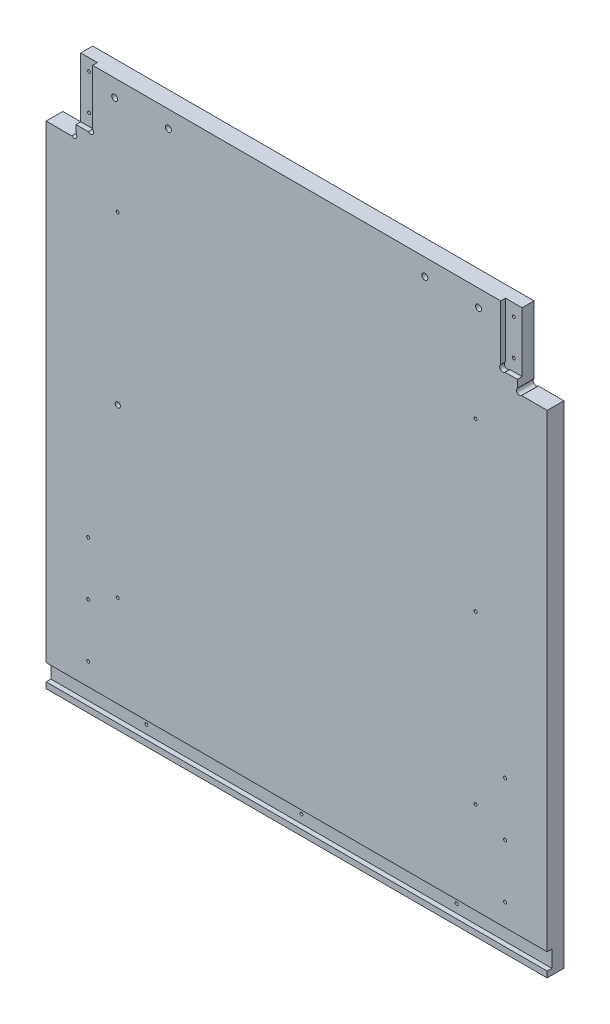
from build123d import *

# Parameters (mm, degrees)
EXTRUDE1_DEPTH     = 17.78
SKETCH4_R          = 3.175
SKETCH4_R_2        = 3.175000002
CUT_EXTRUDE1_DEPTH = 17.78
SKETCH6_R          = 1.5875
SKETCH6_R_2        = 2.777849083
CUT_EXTRUDE3_DEPTH = 17.78
SKETCH5_W          = 17.78
SKETCH5_H          = 63.50740041
SKETCH5_H_2        = 63.507400408
CUT_EXTRUDE2_DEPTH = 5.08
SKETCH7_R          = 3.302
CUT_EXTRUDE4_DEPTH = 5.08
SKETCH9_R          = 3.175
CUT_EXTRUDE5_DEPTH = 17.78


with BuildPart() as part:
    # Sketch3 → Extrude1 (new body)
    with BuildSketch(Plane.XY):
        Polygon((10806.641666666, -6342.0625), (11340.041666666, -6342.0625), (11340.041666666, -5818.736838581), (11308.291666667, -5818.736838581), (11308.291666667, -5742.536838581), (10838.391666667, -5742.536838581), (10838.391666667, -5818.736838581), (10806.641666666, -5818.736838581), align=None)
    extrude(amount=-EXTRUDE1_DEPTH)

    # Sketch4 → Cut-Extrude1 (cut)
    with BuildSketch(Plane.XY):
        with Locations((11310.536730697, -5816.491774551)):
            Circle(SKETCH4_R)
        with Locations((10836.146602637, -5816.491774551)):
            Circle(SKETCH4_R_2)
    extrude(amount=-CUT_EXTRUDE1_DEPTH, mode=Mode.SUBTRACT)

    # Sketch6 → Cut-Extrude3 (cut)
    with BuildSketch(Plane.XY):
        with Locations((10851.409166666, -6294.4375)):
            Circle(SKETCH6_R)
        with Locations((10908.241666666, -6326.8225)):
            Circle(SKETCH6_R)
        with Locations((11073.341666666, -6326.8225)):
            Circle(SKETCH6_R)
        with Locations((11238.441666666, -6326.8225)):
            Circle(SKETCH6_R)
        with Locations((11295.274166666, -6294.4375)):
            Circle(SKETCH6_R)
        with Locations((11295.274166666, -6237.2875)):
            Circle(SKETCH6_R)
        with Locations((11263.841666666, -6220.099669291)):
            Circle(SKETCH6_R)
        with Locations((11295.274166666, -6180.1375)):
            Circle(SKETCH6_R)
        with Locations((11263.841666666, -6042.299669291)):
            Circle(SKETCH6_R)
        with Locations((11263.841666666, -5864.499669291)):
            Circle(SKETCH6_R)
        with Locations((11299.401666666, -5793.344238991)):
            Circle(SKETCH6_R)
        with Locations((11299.401666666, -5755.236838581)):
            Circle(SKETCH6_R)
        with Locations((10847.281666666, -5755.236838581)):
            Circle(SKETCH6_R)
        with Locations((10847.281666666, -5793.344238991)):
            Circle(SKETCH6_R)
        with Locations((10882.841666666, -6042.299669291)):
            Circle(SKETCH6_R_2)
        with Locations((10851.409166666, -6180.1375)):
            Circle(SKETCH6_R)
        with Locations((10882.841666666, -6220.099669291)):
            Circle(SKETCH6_R)
        with Locations((10851.409166666, -6237.2875)):
            Circle(SKETCH6_R)
        with Locations((10882.841666666, -5864.499669291)):
            Circle(SKETCH6_R)
    extrude(amount=-CUT_EXTRUDE3_DEPTH, mode=Mode.SUBTRACT)

    # Sketch5 → Cut-Extrude2 (cut)
    with BuildSketch(Plane.XY):
        Polygon((11073.341666666, -6317.9325), (10806.641666666, -6317.9325), (10806.641666666, -6335.7125), (11340.041666666, -6335.7125), (11340.041666666, -6317.9325), align=None)
        with Locations((10847.281666667, -5774.290538786)):
            Rectangle(SKETCH5_W, SKETCH5_H)
        with Locations((11299.401666667, -5774.290538785)):
            Rectangle(SKETCH5_W, SKETCH5_H_2)
    extrude(amount=-CUT_EXTRUDE2_DEPTH, mode=Mode.SUBTRACT)

    # Sketch7 → Cut-Extrude4 (cut)
    with BuildSketch(Plane.XY):
        with Locations((10853.926602637, -5803.79917496)):
            Circle(SKETCH7_R)
        with Locations((11292.756730697, -5803.799174959)):
            Circle(SKETCH7_R)
    extrude(amount=-CUT_EXTRUDE4_DEPTH, mode=Mode.SUBTRACT)

    # Sketch9 → Cut-Extrude5 (cut)
    with BuildSketch(Plane.XY):
        with Locations((10879.616654067, -5760.644320781)):
            Circle(SKETCH9_R)
        with Locations((10936.816666667, -5760.644320781)):
            Circle(SKETCH9_R)
        with Locations((11209.816654067, -5760.644320781)):
            Circle(SKETCH9_R)
        with Locations((11267.016666667, -5760.644320781)):
            Circle(SKETCH9_R)
    extrude(amount=-CUT_EXTRUDE5_DEPTH, mode=Mode.SUBTRACT)


solid = part.part
